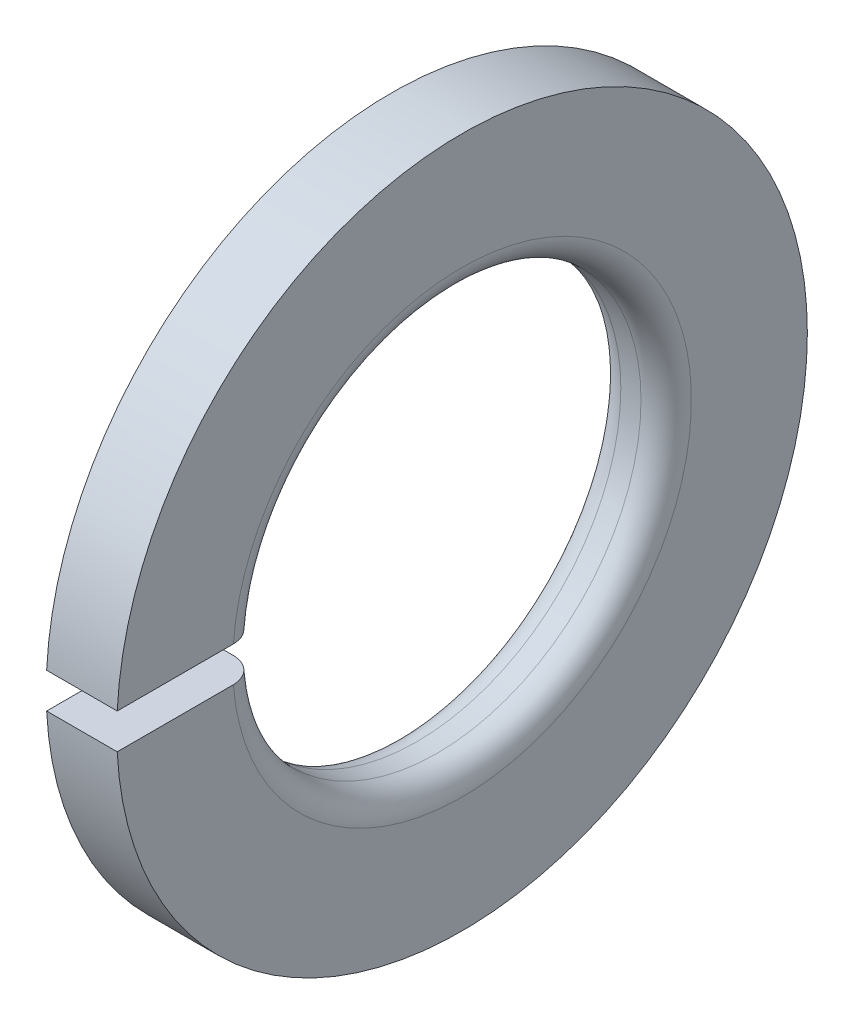
from build123d import *

# Parameters (mm, degrees)
SKETCH2_W = 1.4
SKETCH2_H = 13.974
GAP_DEPTH = 20.576005721


with BuildPart() as part:
    # Sketch1 → Base-Revolve (revolve)
    with BuildSketch(Plane.XY):
        with BuildLine():
            Line((0, 9.1), (0, 13.7))
            Line((0, 13.7), (-2.8, 13.7))
            Line((-2.8, 13.7), (-2.8, 9.1))
            ThreePointArc((-2.8, 9.1), (-2.507106781, 8.392893219), (-1.8, 8.1))
            Line((-1.8, 8.1), (-1, 8.1))
            ThreePointArc((-1, 8.1), (-0.292893219, 8.392893219), (0, 9.1))
        make_face()
    revolve(axis=Axis((-34.925, 0, 0), (1, 0, 0)))

    # Sketch2 → Gap (cut, through all)
    with BuildSketch(Plane(origin=(0, 0, 0), x_dir=(0, -1, 0), z_dir=(-1, 0, 0))):
        with Locations((0, 6.987)):
            Rectangle(SKETCH2_W, SKETCH2_H)
    extrude(amount=GAP_DEPTH, mode=Mode.SUBTRACT)


solid = part.part
